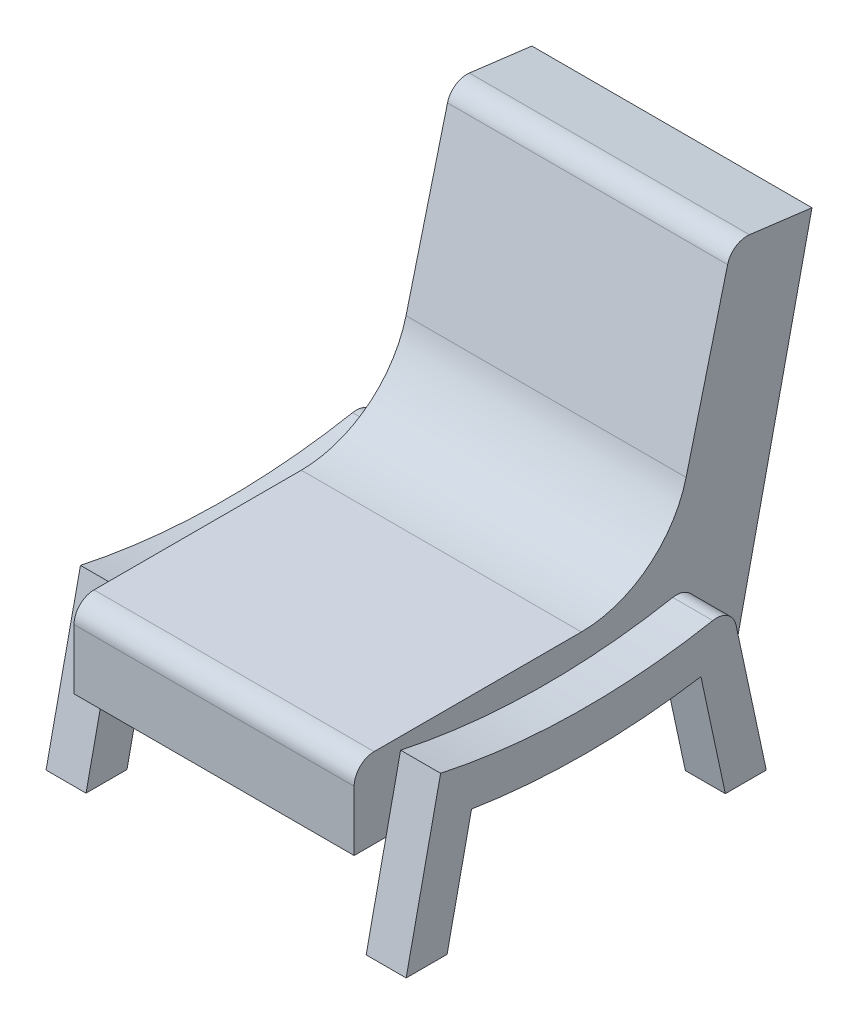
from build123d import *

# Parameters (mm, degrees)
BOSS_EXTRUDE1_DEPTH = 10
FILLET1_R           = 5
BOSS_EXTRUDE2_DEPTH = 35
FILLET2_R           = 5


with BuildPart() as part:
    # Sketch1 → Boss-Extrude1 (new body)
    with BuildSketch(Plane(origin=(0, 0, 0), x_dir=(0, 0, -1), z_dir=(1, 0, 0))):
        with BuildLine():
            Line((-45, 0), (-36.39286513, 40))
            ThreePointArc((-36.39286513, 40), (0, 36.128824769), (36.39286513, 40))
            Line((36.39286513, 40), (45, 0))
            Line((45, 0), (34.771110854, 0))
            Line((34.771110854, 0), (28.662747002, 28.387443413))
            ThreePointArc((28.662747002, 28.387443413), (0, 26.128824769), (-28.662747002, 28.387443413))
            Line((-28.662747002, 28.387443413), (-34.771110854, 0))
            Line((-34.771110854, 0), (-45, 0))
        make_face()
    extrude(amount=BOSS_EXTRUDE1_DEPTH)

    # Fillet1
    fillet1_edges = [part.edges().sort_by_distance(p)[0] for p in [
        (5, 40, -36.39286513),
    ]]
    fillet(fillet1_edges, radius=FILLET1_R)


with BuildPart() as body_2:
    # Mirror3: mirrored copy
    add(part.part.mirror(Plane(origin=(45, 0, 0), x_dir=(0, 0, 1), z_dir=(1, 0, 0))))


with BuildPart() as part_1:
    add(part.part)

    add(body_2.part)  # Boss-Extrude2 merges body 2
    # Sketch2 → Boss-Extrude2 (add, symmetric)
    with BuildSketch(Plane(origin=(45, 0, 0), x_dir=(0, 0, -1), z_dir=(1, 0, 0))):
        with BuildLine():
            Line((-48, 23), (48, 23))
            Line((48, 23), (66.416945106, 106))
            Line((66.416945106, 106), (46.416945106, 108.51539025))
            Line((46.416945106, 108.51539025), (45.96709586, 106.741704173))
            Line((45.96709586, 106.741704173), (34.965043573, 63.362311747))
            ThreePointArc((34.965043573, 63.362311747), (25.373507712, 48.690171483), (8.793664269, 43))
            Line((8.793664269, 43), (-43, 43))
            ThreePointArc((-43, 43), (-46.535533906, 41.535533906), (-48, 38))
            Line((-48, 38), (-48, 23))
        make_face()
    extrude(amount=BOSS_EXTRUDE2_DEPTH, both=True)

    # Fillet2
    fillet2_edges = [part_1.edges().sort_by_distance(p)[0] for p in [
        (45, 108.51539025, -46.416945106),
    ]]
    fillet(fillet2_edges, radius=FILLET2_R)


solid = part_1.part
